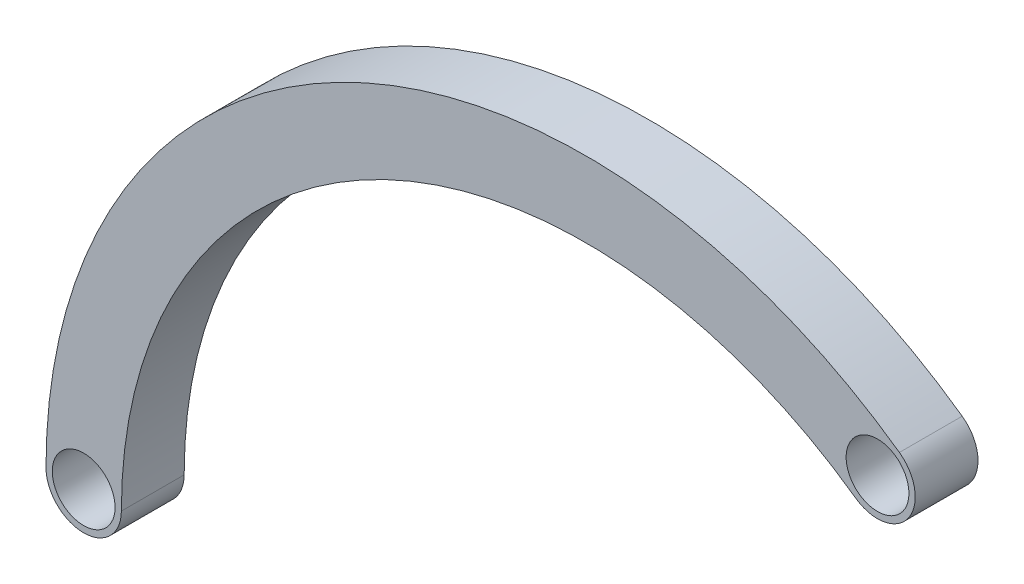
from build123d import *

# Parameters (mm, degrees)
SKETCH1_R           = 2.5
BOSS_EXTRUDE1_DEPTH = 5


with BuildPart() as part:
    # Sketch1 → Boss-Extrude1 (new body)
    with BuildSketch(Plane.XY):
        with BuildLine():
            ThreePointArc((64.950617284, 35.020946548), (20.300717566, 38.222222222), (-3, 0))
            ThreePointArc((-3, 0), (0, -3), (3, 0))
            ThreePointArc((3, 0), (23.04945465, 32.888888889), (61.469135802, 30.134302844))
            ThreePointArc((61.469135802, 30.134302844), (65.653198395, 30.836883955), (64.950617284, 35.020946548))
        make_face()
        Circle(SKETCH1_R, mode=Mode.SUBTRACT)
        with Locations((63.209876543, 32.577624696)):
            Circle(SKETCH1_R, mode=Mode.SUBTRACT)
    extrude(amount=BOSS_EXTRUDE1_DEPTH)


solid = part.part
